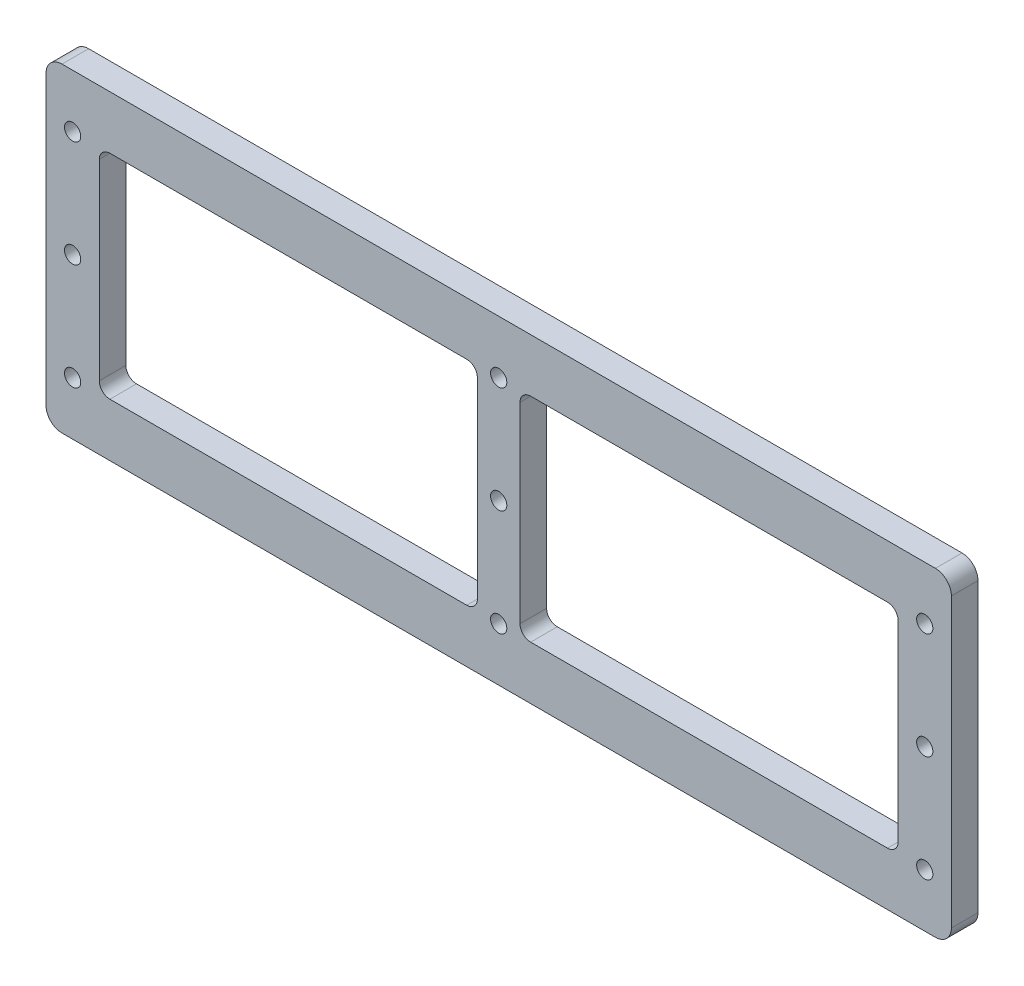
from build123d import *

# Parameters (mm, degrees)
SKETCH_1_W          = 170
SKETCH_1_H          = 60
EXTRUDE_1_DEPTH     = 5
SKETCH_2_W          = 150
SKETCH_2_H          = 40
CUT_EXTRUDE_1_DEPTH = 5
SKETCH_3_W          = 8
SKETCH_3_H          = 40
EXTRUDE_2_DEPTH     = 5
FILLET_1_R          = 3
FILLET_2_R          = 2
SKETCH_4_R          = 1.525
CUT_EXTRUDE_2_DEPTH = 5


with BuildPart() as part:
    # 草图1 → 凸台-拉伸1 (new body)
    with BuildSketch(Plane.XY):
        Rectangle(SKETCH_1_W, SKETCH_1_H)
    extrude(amount=EXTRUDE_1_DEPTH)

    # 草图2 → 切除-拉伸1 (cut)
    with BuildSketch(Plane.XY.offset(5)):
        Rectangle(SKETCH_2_W, SKETCH_2_H)
    extrude(amount=-CUT_EXTRUDE_1_DEPTH, mode=Mode.SUBTRACT)

    # 草图3 → 凸台-拉伸2 (add)
    with BuildSketch(Plane.XY.offset(5)):
        Rectangle(SKETCH_3_W, SKETCH_3_H)
    extrude(amount=-EXTRUDE_2_DEPTH)

    # 圆角1
    fillet_1_edges = [part.edges().sort_by_distance(p)[0] for p in [
        (85, -30, 2.5),
        (-85, -30, 2.5),
        (-85, 30, 2.5),
        (85, 30, 2.5),
    ]]
    fillet(fillet_1_edges, radius=FILLET_1_R)

    # 圆角2
    fillet_2_edges = [part.edges().sort_by_distance(p)[0] for p in [
        (75, 20, 2.5),
        (75, -20, 2.5),
        (-75, -20, 2.5),
        (-75, 20, 2.5),
        (-4, 20, 2.5),
        (-4, -20, 2.5),
        (4, -20, 2.5),
        (4, 20, 2.5),
    ]]
    fillet(fillet_2_edges, radius=FILLET_2_R)

    # 草图4 → 切除-拉伸2 (cut)
    with BuildSketch(Plane(origin=(0, 0, 0), x_dir=(-1, 0, 0), z_dir=(0, 0, -1))):
        with Locations((80, 20)):
            Circle(SKETCH_4_R)
        with Locations((80, 0)):
            Circle(SKETCH_4_R)
        with Locations((0, -20)):
            Circle(SKETCH_4_R)
        with Locations((0, 20)):
            Circle(SKETCH_4_R)
        with Locations((-80, 20)):
            Circle(SKETCH_4_R)
        with Locations((-80, 0)):
            Circle(SKETCH_4_R)
        with Locations((-80, -20)):
            Circle(SKETCH_4_R)
        Circle(SKETCH_4_R)
        with Locations((80, -20)):
            Circle(SKETCH_4_R)
    extrude(amount=-CUT_EXTRUDE_2_DEPTH, mode=Mode.SUBTRACT)


solid = part.part
